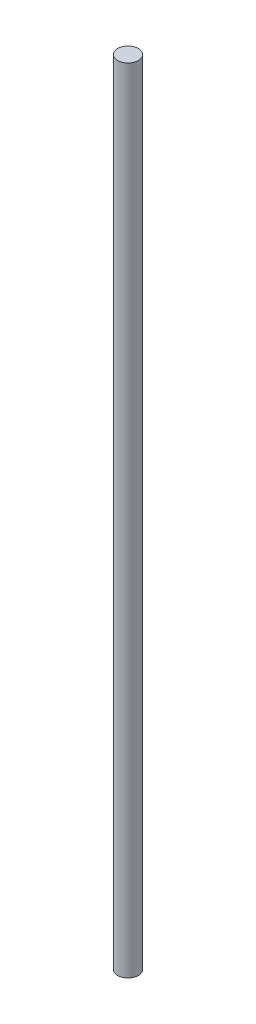
from build123d import *

# Parameters (mm, degrees)
SKETCH1_R           = 6
BOSS_EXTRUDE1_DEPTH = 457


with BuildPart() as part:
    # Sketch1 → Boss-Extrude1 (new body)
    with BuildSketch(Plane(origin=(0, 0, 0), x_dir=(1, 0, 0), z_dir=(0, 1, 0))):
        with Locations(Location((0, 0, 0), (0, 0, 270))):
            Circle(SKETCH1_R)
    extrude(amount=BOSS_EXTRUDE1_DEPTH)


solid = part.part
